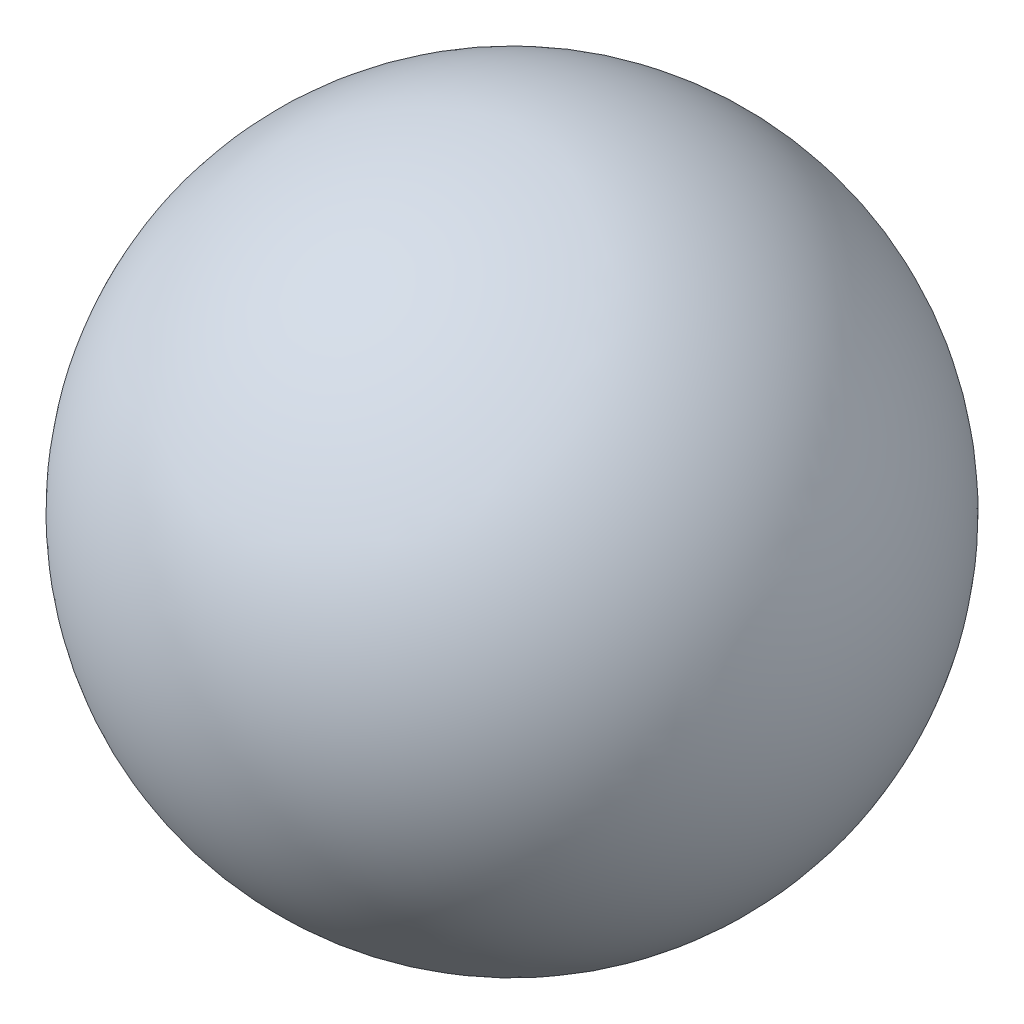
from build123d import *


with BuildPart() as part:
    # Sketch1 → Revolve4 (revolve)
    with BuildSketch(Plane(origin=(0, 0, 0), x_dir=(1, 0, 0), z_dir=(0, 1, 0))):
        with BuildLine():
            Line((0, 0), (19.05, 0))
            ThreePointArc((19.05, 0), (9.525, 9.525), (0, 0))
        make_face()
    revolve(axis=Axis((0, 0, 0), (1, 0, 0)))


solid = part.part
